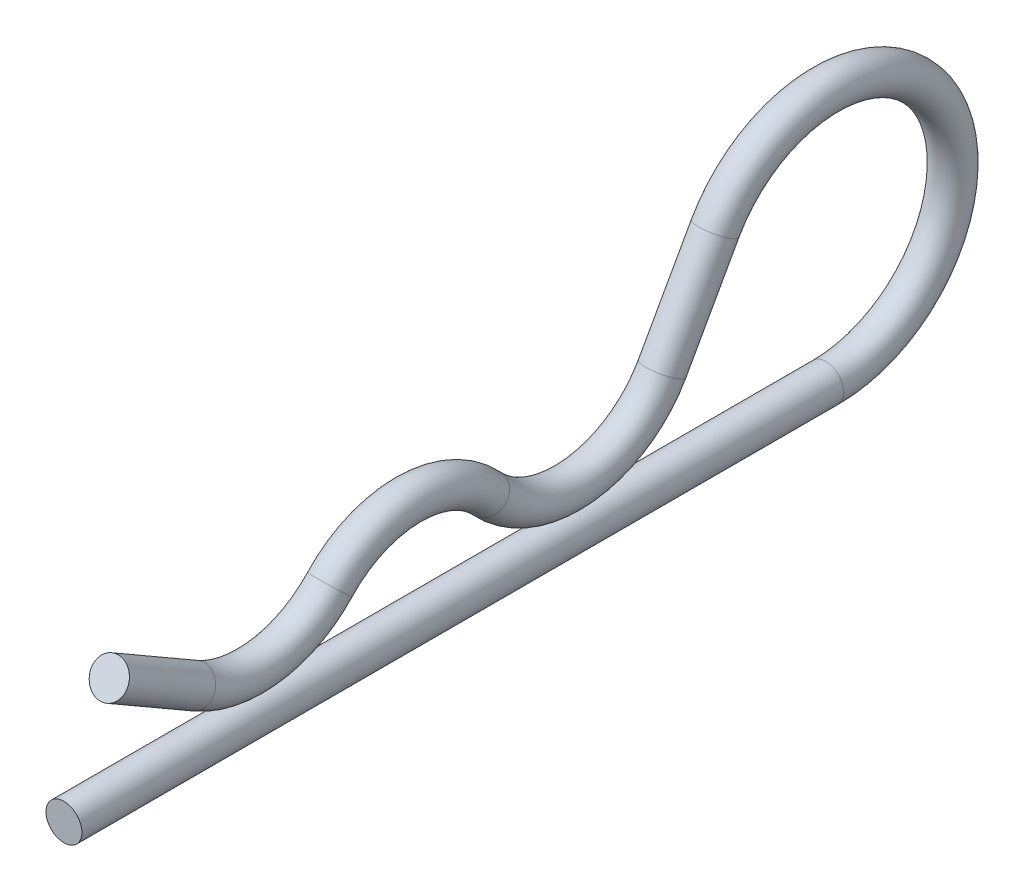
from build123d import *

# Parameters (mm, degrees)
SKETCH2_R = 0.7874


with BuildPart() as part:
    # Sweep1: sweep along a path in Sketch3
    with BuildLine(Plane(origin=(0, 0, 0), x_dir=(0, 0, -1), z_dir=(1, 0, 0))) as sweep1_path:
        Line((-14.690725, 4.46971136), (-10.918115093, 2.291594014))
        ThreePointArc((-10.918115093, 2.291594014), (-7.822279539, 1.70745489), (-5.03914766, 3.183799445))
        ThreePointArc((-5.03914766, 3.183799445), (-1.59385, 4.691125118), (1.85144766, 3.183799445))
        ThreePointArc((1.85144766, 3.183799445), (5.912211042, 1.686940138), (9.508009051, 4.095388542))
        Line((9.508009051, 4.095388542), (11.828660509, 8.254232499))
        ThreePointArc((11.828660509, 8.254232499), (21.461025456, 8.359936928), (16.6751, 0))
        Line((16.6751, 0), (-16.6751, 0))
    # Sketch2 → Sweep1 (sweep)
    with BuildSketch(Plane.XY.offset(16.6751)):
        Circle(SKETCH2_R)
    sweep(path=sweep1_path.line)


solid = part.part
